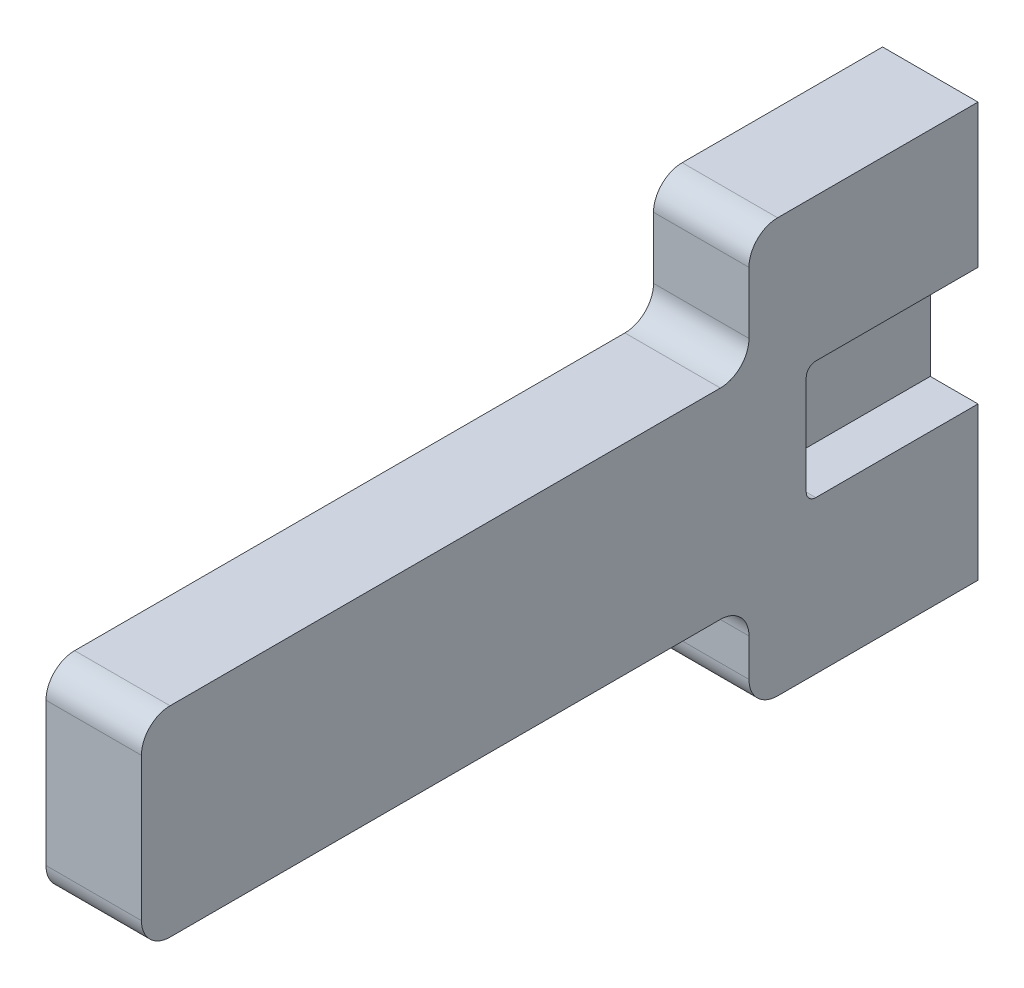
from build123d import *

# Parameters (mm, degrees)
SALIENTE_EXTRUIR1_DEPTH = 10
CROQUIS2_W              = 18
CROQUIS2_H              = 12.394708995
CORTAR_EXTRUIR1_DEPTH   = 5
REDONDEO1_R             = 3
REDONDEO2_R             = 3
REDONDEO3_R             = 1


with BuildPart() as part:
    # Croquis1 → Saliente-Extruir1 (new body)
    with BuildSketch(Plane(origin=(0, 0, 0), x_dir=(0, 0, -1), z_dir=(1, 0, 0))):
        Polygon((0, -10.216508635), (0, 27.394708995), (-24, 27.394708995), (-24, 14.942424084), (-87.663818946, 14.942424084), (-87.663818946, -6.057575916), (-24, -6.057575916), (-24, -16.002849809), (0, -16.002849809), align=None)
    extrude(amount=SALIENTE_EXTRUIR1_DEPTH)

    # Croquis2 → Cortar-Extruir1 (cut)
    with BuildSketch(Plane(origin=(10, 0, 0), x_dir=(0, 0, -1), z_dir=(1, 0, 0))):
        with Locations((-9, 6.197354498)):
            Rectangle(CROQUIS2_W, CROQUIS2_H)
    extrude(amount=-CORTAR_EXTRUIR1_DEPTH, mode=Mode.SUBTRACT)

    # Redondeo1
    redondeo1_edges = [part.edges().sort_by_distance(p)[0] for p in [
        (5, -6.057575916, 24),
        (5, 14.942424084, 24),
    ]]
    fillet(redondeo1_edges, radius=REDONDEO1_R)

    # Redondeo2
    redondeo2_edges = [part.edges().sort_by_distance(p)[0] for p in [
        (5, -16.002849809, 24),
        (5, -6.057575916, 87.663818946),
        (5, 14.942424084, 87.663818946),
        (5, 27.394708995, 24),
    ]]
    fillet(redondeo2_edges, radius=REDONDEO2_R)

    # Redondeo3
    redondeo3_edges = [part.edges().sort_by_distance(p)[0] for p in [
        (7.5, 0, 18),
        (7.5, 12.394708995, 18),
    ]]
    fillet(redondeo3_edges, radius=REDONDEO3_R)


solid = part.part
